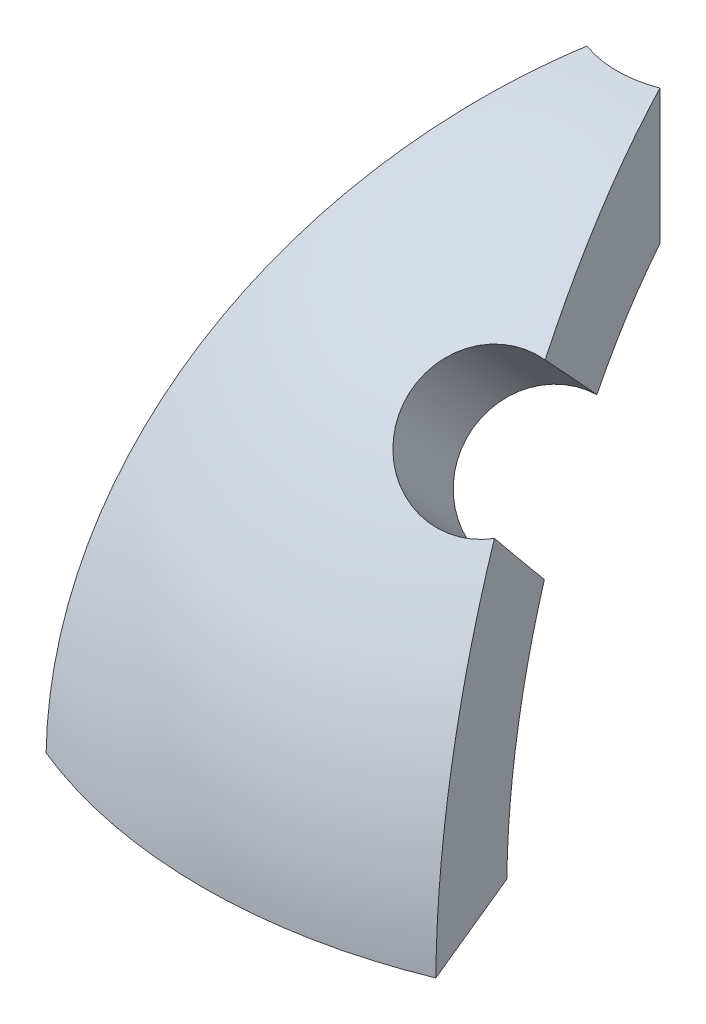
from build123d import *

# Parameters (mm, degrees)
REVOLVE1_ANGLE            = 45
CUT_EXTRUDE1_DEPTH        = 28.647117169
CUT_EXTRUDE1_DEPTH_BACK   = 28.647117169
CUT_EXTRUDE4_REACH        = 29.998
CUT_EXTRUDE4_START_RADIUS = 14.22
CUT_EXTRUDE4_END_RADIUS   = 14.22
CUT_EXTRUDE5_DEPTH        = 27.866361913
CUT_EXTRUDE5_DEPTH_BACK   = 27.866361913
SKETCH9_R                 = 2.6035


with BuildPart() as part:
    # Sketch1 → Revolve1 (revolve, symmetric)
    with BuildSketch(Plane(origin=(0, 0, 0), x_dir=(0, 0, -1), z_dir=(1, 0, 0))) as revolve1_sk:
        with BuildLine():
            Line((-14.217802221, 0.25), (-19.048359509, 0.25))
            ThreePointArc((-19.048359509, 0.25), (-14.676690222, 12.144845166), (-3.81, 18.66511184))
            Line((-3.81, 18.66511184), (-3.81, 13.700083941))
            ThreePointArc((-3.81, 13.700083941), (-11.246181696, 8.70240181), (-14.217802221, 0.25))
        make_face()
    revolve(axis=Axis((0, 0, 0), (0, 1, 0)), revolution_arc=REVOLVE1_ANGLE / 2)
    revolve(revolve1_sk.sketch, axis=Axis((0, 0, 0), (0, -1, 0)), revolution_arc=REVOLVE1_ANGLE / 2)

    # Sketch2 → Cut-Extrude1 (cut, two sides: drawn at the far end of the back side and taken through both)
    with BuildSketch(Plane(origin=(0, 0, 0), x_dir=(1, 0, 0), z_dir=(0, 1, 0)).offset(-CUT_EXTRUDE1_DEPTH_BACK)):
        with BuildLine():
            Line((7.289491598, -17.598389479), (1.458023877, -3.519981019))
            ThreePointArc((1.458023877, -3.519981019), (1.400077392, -3.543428184), (1.341754023, -3.5659215))
            Line((1.341754023, -3.5659215), (7.173849701, -17.645845983))
            ThreePointArc((7.173849701, -17.645845983), (7.231709577, -17.622212591), (7.289491598, -17.598389479))
        make_face()
        with BuildLine():
            Line((-7.173849701, -17.645845983), (-1.341754023, -3.5659215))
            ThreePointArc((-1.341754023, -3.5659215), (-1.400077392, -3.543428184), (-1.458023877, -3.519981019))
            Line((-1.458023877, -3.519981019), (-7.289491598, -17.598389479))
            ThreePointArc((-7.289491598, -17.598389479), (-7.231709577, -17.622212591), (-7.173849701, -17.645845983))
        make_face()
    extrude(amount=CUT_EXTRUDE1_DEPTH + CUT_EXTRUDE1_DEPTH_BACK, mode=Mode.SUBTRACT)

    # Cut-Extrude4: from a sphere face, 29.998 long prism both ways, kept between that surface and its translate by the depth
    cut_extrude4_start = Location((0, 0, 0)) * Sphere(CUT_EXTRUDE4_START_RADIUS, mode=Mode.PRIVATE)
    cut_extrude4_end = Location((0, 0.145802388, 0.351998102)) * Sphere(CUT_EXTRUDE4_END_RADIUS, mode=Mode.PRIVATE)
    # Sketch8 → Cut-Extrude4 (cut, from a surface)
    with BuildSketch(Plane(origin=(0, 0, 0), x_dir=(-1, 0, 0), z_dir=(0, 0.3826834323650899, 0.9238795325112868)), mode=Mode.PRIVATE) as cut_extrude4_sk1:
        Polygon((-1.253717949, -0.505052528), (1.481666667, -0.505052528), (-0.854807692, 4.053921831), (-1.199402043, 3.864261374), (0.80672476, -0.049155093), (-1.253717949, -0.049155093), align=None)
    cut_extrude4_tool1 = extrude(cut_extrude4_sk1.sketch, amount=CUT_EXTRUDE4_REACH, both=True, mode=Mode.PRIVATE)
    add(((cut_extrude4_tool1 - cut_extrude4_start) & cut_extrude4_end).solids().sort_by_distance((-0.113974, 5.809704, 12.845032))[0], mode=Mode.SUBTRACT)

    # Sketch9 → Cut-Extrude5 (cut, two sides: drawn at the far end of the back side and taken through both)
    with BuildSketch(Plane(origin=(5.827608686, 18.858537854, 17.935535314), x_dir=(-0.8206892018836905, -0.23968096505674552, 0.5186735668038023), z_dir=(-0.2185080122244017, -0.7071067811865477, -0.67249851196396)).offset(-CUT_EXTRUDE5_DEPTH_BACK)):
        Circle(SKETCH9_R)
    extrude(amount=CUT_EXTRUDE5_DEPTH + CUT_EXTRUDE5_DEPTH_BACK, mode=Mode.SUBTRACT)


solid = part.part
